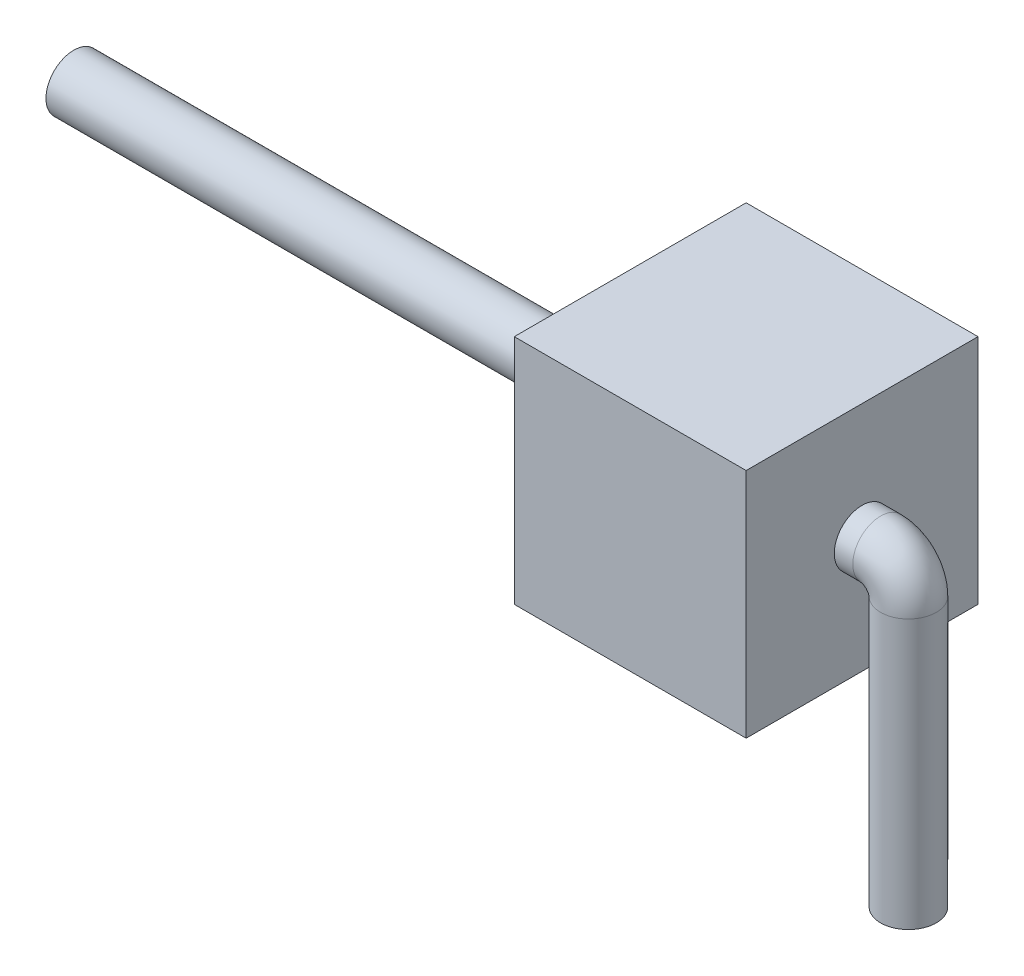
from build123d import *

# Parameters (mm, degrees)
SKETCH_1_W      = 2.5
SKETCH_1_H      = 2.5
EXTRUDE_1_DEPTH = 1.25
SKETCH_3_R      = 0.3


with BuildPart() as part:
    # Эскиз1 → Вытянуть1 (new, symmetric)
    with BuildSketch(Plane(origin=(0, 0, 0), x_dir=(0, 0, -1), z_dir=(1, 0, 0))):
        Rectangle(SKETCH_1_W, SKETCH_1_H)
    extrude(amount=EXTRUDE_1_DEPTH, both=True)

    # По траектории1: sweep along a path in Эскиз2
    with BuildLine(Plane.XY) as sweep_1_path:
        Line((-7.25, 0), (1.45, 0))
        ThreePointArc((1.45, 0), (1.662132034, -0.087867966), (1.75, -0.3))
        Line((1.75, -0.3), (1.75, -3.2))
    # Эскиз3 → По траектории1 (sweep)
    with BuildSketch(Plane(origin=(-7.25, 0, 0), x_dir=(0, 0, -1), z_dir=(1, 0, 0))):
        Circle(SKETCH_3_R)
    sweep(path=sweep_1_path.line)


solid = part.part
